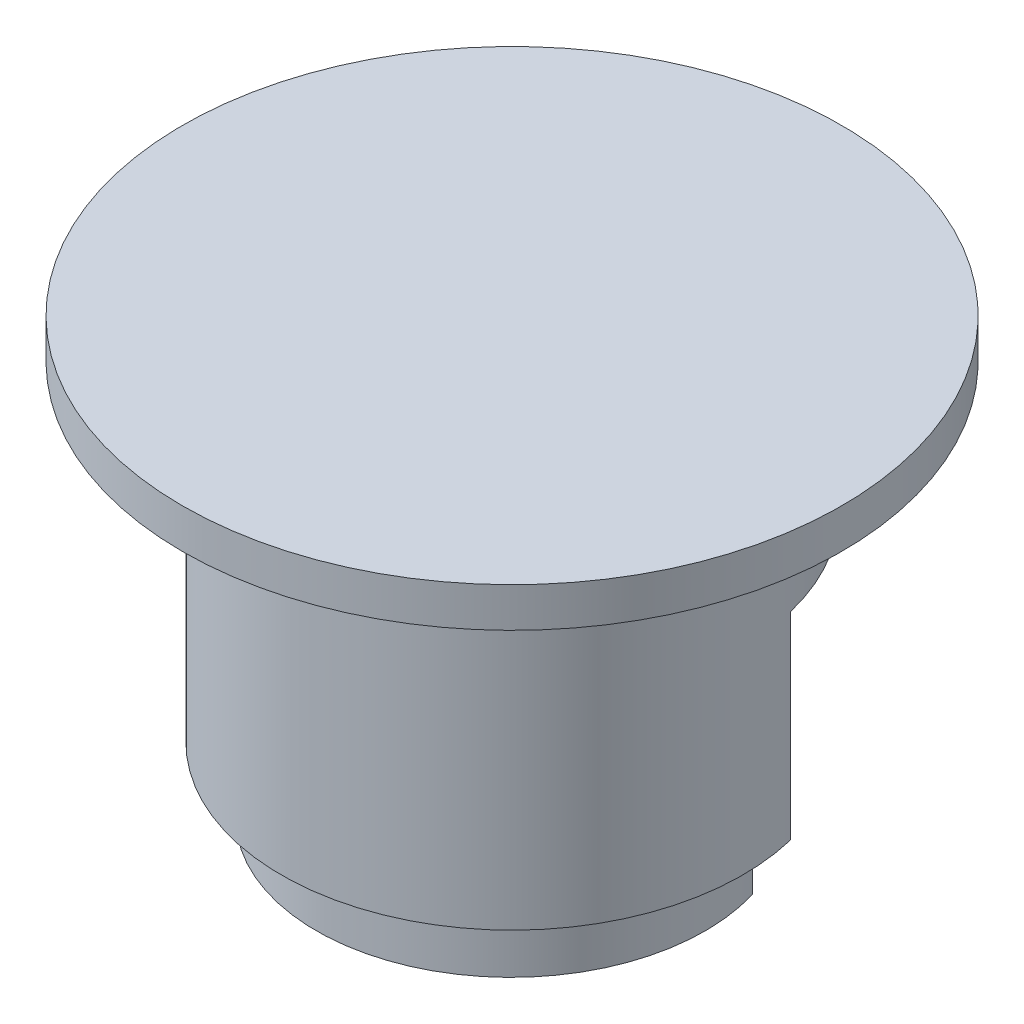
from build123d import *

# Parameters (mm, degrees)
SKETCH_1_R               = 50
EXTRUDE_1_DEPTH          = 6
SKETCH_2_R               = 35
EXTRUDE_2_DEPTH          = 60
SKETCH_4_W               = 77.448717432
SKETCH_4_H               = 33
CUT_EXTRUDE_2_DEPTH      = 40
SKETCH_5_W               = 12
SKETCH_5_H               = 45
CUT_EXTRUDE_3_DEPTH      = 30
CUT_EXTRUDE_4_DEPTH      = 97.726418315
CUT_EXTRUDE_4_DEPTH_BACK = 60
SKETCH_7_OUTSIDE_W       = 133.212
SKETCH_7_OUTSIDE_H       = 133.212
SKETCH_7_OUTSIDE_R       = 29.5
CUT_EXTRUDE_5_DEPTH      = 10
CUT_EXTRUDE_6_DEPTH      = 20
SKETCH_9_R               = 1.1
CUT_EXTRUDE_7_DEPTH      = 10
FILLET_1_R               = 2


with BuildPart() as part:
    # 草图1 → 凸台-拉伸1 (new body)
    with BuildSketch(Plane(origin=(0, 0, 0), x_dir=(1, 0, 0), z_dir=(0, 1, 0))):
        with Locations(Location((0, 0, 0), (0, 0, 270))):
            Circle(SKETCH_1_R)
    extrude(amount=EXTRUDE_1_DEPTH)

    # 草图2 → 凸台-拉伸2 (add)
    with BuildSketch(Plane.XZ):
        with Locations(Location((0, 0, 0), (0, 0, 270))):
            Circle(SKETCH_2_R)
    extrude(amount=EXTRUDE_2_DEPTH)

    # 草图4 → 切除-拉伸2 (cut)
    with BuildSketch(Plane.XZ.offset(60)):
        with Locations((2.029578549, -24.707284506)):
            Rectangle(SKETCH_4_W, SKETCH_4_H)
    extrude(amount=-CUT_EXTRUDE_2_DEPTH, mode=Mode.SUBTRACT)

    # 草图5 → 切除-拉伸3 (cut)
    with BuildSketch(Plane(origin=(0, 0, -8.207284506), x_dir=(-1, 0, 0), z_dir=(0, 0, -1))):
        with Locations((0, -42.5)):
            Rectangle(SKETCH_5_W, SKETCH_5_H)
    extrude(amount=-CUT_EXTRUDE_3_DEPTH, mode=Mode.SUBTRACT)

    # 草图6 → 切除-拉伸4 (cut, two sides: drawn at the far end of the back side and taken through both)
    with BuildSketch(Plane.XZ.offset(60).offset(-CUT_EXTRUDE_4_DEPTH_BACK)):
        with BuildLine():
            Line((-27.5, 0), (-25.651821524, -3.41877994))
            Line((-25.651821524, -3.41877994), (25.981995499, -3.41877994))
            Line((25.981995499, -3.41877994), (27.5, 0))
            ThreePointArc((27.5, 0), (0, 27.5), (-27.5, 0))
        make_face()
    extrude(amount=CUT_EXTRUDE_4_DEPTH + CUT_EXTRUDE_4_DEPTH_BACK, mode=Mode.SUBTRACT)

    # 草图7 outside → 切除-拉伸5 (cut)
    with BuildSketch(Plane.XZ.offset(60)):
        Rectangle(SKETCH_7_OUTSIDE_W, SKETCH_7_OUTSIDE_H)
        with Locations((0, 0.184250616)):
            Circle(SKETCH_7_OUTSIDE_R, mode=Mode.SUBTRACT)
    extrude(amount=-CUT_EXTRUDE_5_DEPTH, mode=Mode.SUBTRACT)

    # 草图8 → 切除-拉伸6 (cut)
    with BuildSketch(Plane.XZ.offset(20)):
        with BuildLine():
            Line((-29.384128464, -11.494001524), (28.615871536, -11.494001524))
            ThreePointArc((28.615871536, -11.494001524), (-0.384128464, -31.448176939), (-29.384128464, -11.494001524))
        make_face()
    extrude(amount=-CUT_EXTRUDE_6_DEPTH, mode=Mode.SUBTRACT)

    # 草图9 → 切除-拉伸7 (cut)
    with BuildSketch(Plane(origin=(0, 0, -8.207284506), x_dir=(-1, 0, 0), z_dir=(0, 0, -1))):
        with Locations((21.25, -28.140331005)):
            Circle(SKETCH_9_R)
        with Locations((21.25, -44.440331005)):
            Circle(SKETCH_9_R)
        with Locations((-21.25, -28.140331005)):
            Circle(SKETCH_9_R)
        with Locations((-21.25, -44.440331005)):
            Circle(SKETCH_9_R)
    extrude(amount=-CUT_EXTRUDE_7_DEPTH, mode=Mode.SUBTRACT)

    # 圆角1
    fillet_1_edges = [part.edges().sort_by_distance(p)[0] for p in [
        (-25.651821524, -30, -3.41877994),
        (27.5, -30, 0),
        (25.981995499, -30, -3.41877994),
        (-27.5, -30, 0),
    ]]
    fillet(fillet_1_edges, radius=FILLET_1_R)


solid = part.part
